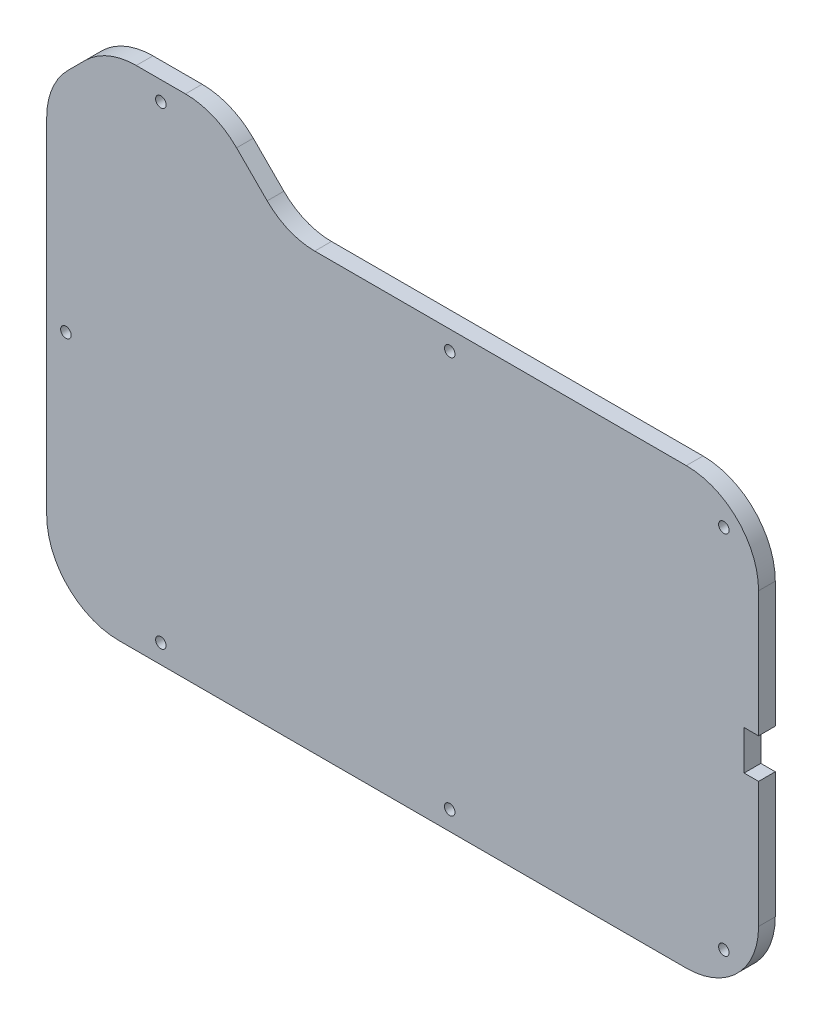
from build123d import *

# Parameters (mm, degrees)
SKETCH1_R           = 1
BOSS_EXTRUDE1_DEPTH = 3.175


with BuildPart() as part:
    # Sketch1 → Boss-Extrude1 (new body)
    with BuildSketch(Plane.XY):
        with BuildLine():
            Line((143.808069079, 20.460501739), (143.808069079, 44.360501739))
            Line((143.808069079, 44.360501739), (141.058069079, 44.360501739))
            Line((141.058069079, 44.360501739), (141.058069079, 51.860501739))
            Line((141.058069079, 51.860501739), (143.808069079, 51.860501739))
            Line((143.808069079, 51.860501739), (143.808069079, 75.76050174))
            ThreePointArc((143.808069079, 75.76050174), (139.780787321, 85.483219981), (130.058069079, 89.51050174))
            Line((130.058069079, 89.51050174), (59.375183039, 89.51050174))
            ThreePointArc((59.375183039, 89.51050174), (54.476835105, 90.484843724), (50.32421624, 93.259534941))
            Line((50.32421624, 93.259534941), (44.500531199, 99.083219981))
            ThreePointArc((44.500531199, 99.083219981), (40.039710153, 102.063845312), (34.777812958, 103.11050174))
            Line((34.777812958, 103.11050174), (25.414810921, 103.11050174))
            ThreePointArc((25.414810921, 103.11050174), (20.152913726, 102.063845312), (15.69209268, 99.083219981))
            Line((15.69209268, 99.083219981), (12.411836559, 95.80296386))
            ThreePointArc((12.411836559, 95.80296386), (9.431211228, 91.342142814), (8.3845548, 86.080245619))
            Line((8.3845548, 86.080245619), (8.3845548, 20.460501739))
            ThreePointArc((8.3845548, 20.460501739), (12.411836559, 10.737783497), (22.1345548, 6.710501739))
            Line((22.1345548, 6.710501739), (130.058069079, 6.710501739))
            ThreePointArc((130.058069079, 6.710501739), (139.780787321, 10.737783497), (143.808069079, 20.460501739))
        make_face()
        with Locations((12.0345548, 52.470373679)):
            Circle(SKETCH1_R, mode=Mode.SUBTRACT)
        with Locations((30.09631194, 99.46050174)):
            Circle(SKETCH1_R, mode=Mode.SUBTRACT)
        with Locations((85.053742799, 85.86050174)):
            Circle(SKETCH1_R, mode=Mode.SUBTRACT)
        with Locations((137.199847569, 82.902280229)):
            Circle(SKETCH1_R, mode=Mode.SUBTRACT)
        with Locations((137.199847569, 13.318723249)):
            Circle(SKETCH1_R, mode=Mode.SUBTRACT)
        with Locations((85.053742799, 10.36050174)):
            Circle(SKETCH1_R, mode=Mode.SUBTRACT)
        with Locations((30.09631194, 10.36050174)):
            Circle(SKETCH1_R, mode=Mode.SUBTRACT)
    extrude(amount=BOSS_EXTRUDE1_DEPTH)


solid = part.part
